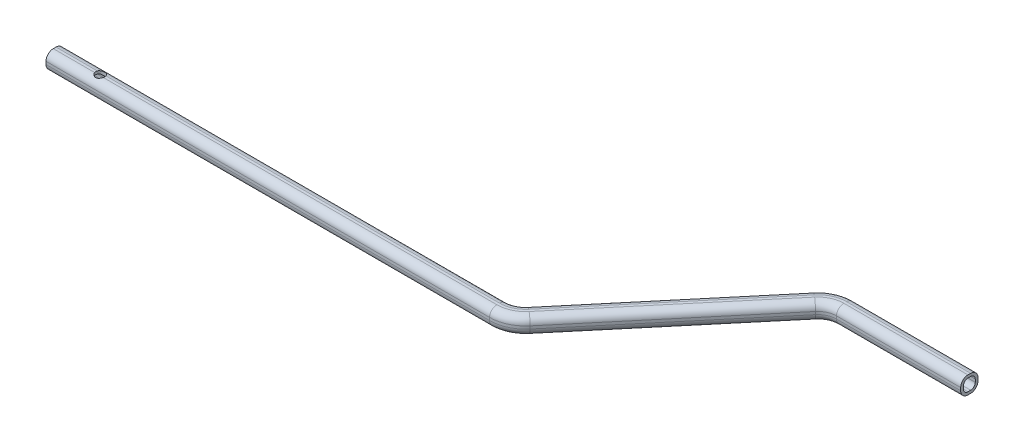
from build123d import *

# Parameters (mm, degrees)
CUT_EXTRUDE3_DEPTH      = 836.299457856
CUT_EXTRUDE3_DEPTH_BACK = 836.299457856
SKETCH21_R              = 5


with BuildPart() as part:
    # Sweep-Thin3: sweep along a curve in space
    with BuildLine() as sweep_thin3_path:
        Line((674.686132166, 0, -191.51111078), (810.696902422, 0, -191.51111078))
        ThreePointArc((651.704798873, 0, -180.79473907), (662.007584314, 0, -188.700344391), (674.686132166, 0, -191.51111078))
        Line((508.992103549, 0, -10.716371709), (651.704798873, 0, -180.79473907))
        ThreePointArc((486.010770255, 0, 0), (498.689318108, 0, -2.810766389), (508.992103549, 0, -10.716371709))
        Line((0, 0, 0), (486.010770255, 0, 0))
    # Sketch2 → Sweep-Thin3 (sweep)
    with BuildSketch(Plane(origin=(0, 0, 0), x_dir=(0, 0, -1), z_dir=(1, 0, 0))):
        with BuildLine():
            Line((1.5, 9.5), (-1.5, 9.5))
            ThreePointArc((-1.5, 9.5), (-7.156854249, 7.156854249), (-9.5, 1.5))
            Line((-9.5, 1.5), (-9.5, -1.5))
            ThreePointArc((-9.5, -1.5), (-7.156854249, -7.156854249), (-1.5, -9.5))
            Line((-1.5, -9.5), (1.5, -9.5))
            ThreePointArc((1.5, -9.5), (7.156854249, -7.156854249), (9.5, -1.5))
            Line((9.5, -1.5), (9.5, 1.5))
            ThreePointArc((9.5, 1.5), (7.156854249, 7.156854249), (1.5, 9.5))
        make_face()
        with BuildLine():
            Line((1.5, 6.5), (-1.5, 6.5))
            ThreePointArc((-1.5, 6.5), (-5.035533906, 5.035533906), (-6.5, 1.5))
            Line((-6.5, 1.5), (-6.5, -1.5))
            ThreePointArc((-6.5, -1.5), (-5.035533906, -5.035533906), (-1.5, -6.5))
            Line((-1.5, -6.5), (1.5, -6.5))
            ThreePointArc((1.5, -6.5), (5.035533906, -5.035533906), (6.5, -1.5))
            Line((6.5, -1.5), (6.5, 1.5))
            ThreePointArc((6.5, 1.5), (5.035533906, 5.035533906), (1.5, 6.5))
        make_face(mode=Mode.SUBTRACT)
    sweep(path=sweep_thin3_path.line)

    # Sketch21 → Cut-Extrude3 (cut, two sides: drawn at the far end of the back side and taken through both)
    with BuildSketch(Plane(origin=(0, 0, 0), x_dir=(1, 0, 0), z_dir=(0, 1, 0)).offset(-CUT_EXTRUDE3_DEPTH_BACK)):
        with Locations(Location((50, 0, 0), (0, 0, 197.457603124))):
            Circle(SKETCH21_R)
    extrude(amount=CUT_EXTRUDE3_DEPTH + CUT_EXTRUDE3_DEPTH_BACK, mode=Mode.SUBTRACT)


solid = part.part
